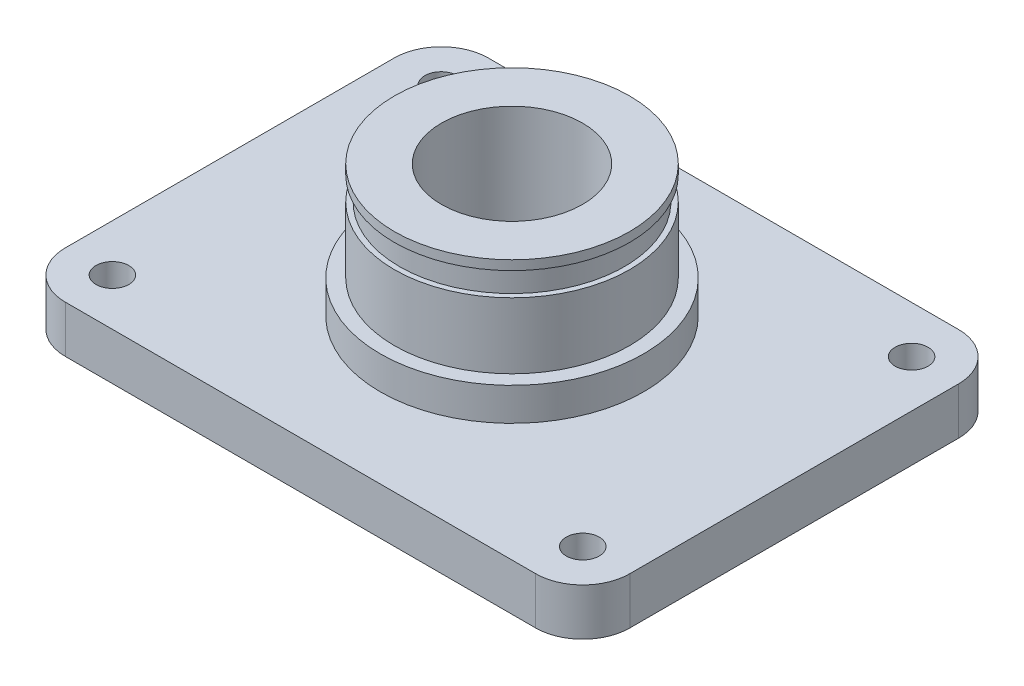
from build123d import *

# Parameters (mm, degrees)
SKETCH1_R           = 12.5
SKETCH1_R_2         = 9.5
BOSS_EXTRUDE1_DEPTH = 14
SKETCH2_W           = 64.506168934
SKETCH2_H           = 47.83380527
BOSS_EXTRUDE2_DEPTH = 5
SKETCH3_R           = 7.5
CUT_EXTRUDE1_DEPTH  = 5
FILLET1_R           = 10
SKETCH4_R           = 41.339159207
SKETCH4_R_2         = 22.478966411
CUT_EXTRUDE2_DEPTH  = 10
SKETCH5_W           = 60
SKETCH5_H           = 44.957932822
SKETCH5_R           = 6
BOSS_EXTRUDE3_DEPTH = 5
FILLET2_R           = 5
SKETCH6_R           = 7.5
CUT_EXTRUDE3_DEPTH  = 10.435721216
SKETCH7_R           = 14
SKETCH7_R_2         = 12.5
BOSS_EXTRUDE4_DEPTH = 3.5
SKETCH8_R           = 13.175914581
SKETCH8_R_2         = 11.95
CUT_EXTRUDE4_DEPTH  = 2.5
BOSS_EXTRUDE5_START = -14
SKETCH9_R           = 9.5
SKETCH9_R_2         = 7.5
BOSS_EXTRUDE5_DEPTH = 14
SKETCH11_R          = 1.75
CUT_EXTRUDE5_DEPTH  = 6.2


with BuildPart() as part:
    # Sketch1 → Boss-Extrude1 (new body)
    with BuildSketch(Plane(origin=(0, 0, 0), x_dir=(1, 0, 0), z_dir=(0, 1, 0))):
        with Locations(Location((0, 0, 0), (0, 0, 270))):
            Circle(SKETCH1_R)
        with Locations(Location((0, 0, 0), (0, 0, 270))):
            Circle(SKETCH1_R_2, mode=Mode.SUBTRACT)
    extrude(amount=BOSS_EXTRUDE1_DEPTH)

    # Sketch2 → Boss-Extrude2 (add)
    with BuildSketch(Plane(origin=(0, 0, 0), x_dir=(-1, 0, 0), z_dir=(0, -1, 0))):
        Rectangle(SKETCH2_W, SKETCH2_H)
    extrude(amount=BOSS_EXTRUDE2_DEPTH)

    # Sketch3 → Cut-Extrude1 (cut)
    with BuildSketch(Plane(origin=(0, 0, 0), x_dir=(1, 0, 0), z_dir=(0, 1, 0))):
        with Locations(Location((0, 0, 0), (0, 0, 270))):
            Circle(SKETCH3_R)
    extrude(amount=-CUT_EXTRUDE1_DEPTH, mode=Mode.SUBTRACT)

    # Fillet1
    fillet1_edges = [part.edges().sort_by_distance(p)[0] for p in [
        (32.253084467, -2.5, -23.916902635),
        (32.253084467, -2.5, 23.916902635),
        (-32.253084467, -2.5, 23.916902635),
        (-32.253084467, -2.5, -23.916902635),
    ]]
    fillet(fillet1_edges, radius=FILLET1_R)

    # Sketch4 → Cut-Extrude2 (cut)
    with BuildSketch(Plane(origin=(0, 0, 0), x_dir=(1, 0, 0), z_dir=(0, 1, 0))):
        Circle(SKETCH4_R)
        with Locations(Location((0, 0, 0), (0, 0, 270))):
            Circle(SKETCH4_R_2, mode=Mode.SUBTRACT)
    extrude(amount=-CUT_EXTRUDE2_DEPTH, mode=Mode.SUBTRACT)

    # Sketch5 → Boss-Extrude3 (add)
    with BuildSketch(Plane(origin=(0, -5, 0), x_dir=(-1, 0, 0), z_dir=(0, -1, 0))):
        Rectangle(SKETCH5_W, SKETCH5_H)
        with Locations(Location((0, 0, 0), (0, 0, 90))):
            Circle(SKETCH5_R, mode=Mode.SUBTRACT)
    extrude(amount=-BOSS_EXTRUDE3_DEPTH)

    # Fillet2
    fillet2_edges = [part.edges().sort_by_distance(p)[0] for p in [
        (30, -2.5, -22.478966411),
        (-30, -2.5, 22.478966411),
        (30, -2.5, 22.478966411),
        (-30, -2.5, -22.478966411),
    ]]
    fillet(fillet2_edges, radius=FILLET2_R)

    # Sketch6 → Cut-Extrude3 (cut)
    with BuildSketch(Plane(origin=(0, -5, 0), x_dir=(-1, 0, 0), z_dir=(0, -1, 0))):
        with Locations(Location((0, 0, 0), (0, 0, 90))):
            Circle(SKETCH6_R)
    extrude(amount=-CUT_EXTRUDE3_DEPTH, mode=Mode.SUBTRACT)

    # Sketch7 → Boss-Extrude4 (add)
    with BuildSketch(Plane(origin=(0, 0, 0), x_dir=(1, 0, 0), z_dir=(0, 1, 0))):
        with Locations(Location((0, 0, 0), (0, 0, 270))):
            Circle(SKETCH7_R)
        with Locations(Location((0, 0, 0), (0, 0, 270))):
            Circle(SKETCH7_R_2, mode=Mode.SUBTRACT)
    extrude(amount=BOSS_EXTRUDE4_DEPTH)

    # Sketch8 → Cut-Extrude4 (cut)
    with BuildSketch(Plane(origin=(0, 13, 0), x_dir=(1, 0, 0), z_dir=(0, 1, 0))):
        Circle(SKETCH8_R)
        with Locations(Location((0, 0, 0), (0, 0, 270))):
            Circle(SKETCH8_R_2, mode=Mode.SUBTRACT)
    extrude(amount=-CUT_EXTRUDE4_DEPTH, mode=Mode.SUBTRACT)

    # Sketch9 → Boss-Extrude5 (add)
    with BuildSketch(Plane(origin=(0, 14, 0), x_dir=(1, 0, 0), z_dir=(0, 1, 0)).offset(BOSS_EXTRUDE5_START)):
        Circle(SKETCH9_R)
        with Locations(Location((0, 0, 0), (0, 0, 90))):
            Circle(SKETCH9_R_2, mode=Mode.SUBTRACT)
    extrude(amount=BOSS_EXTRUDE5_DEPTH)

    # Sketch11 → Cut-Extrude5 (cut)
    with BuildSketch(Plane(origin=(0, 0, 0), x_dir=(1, 0, 0), z_dir=(0, 1, 0))):
        with Locations(Location((-25, 17.478966411, 0), (0, 0, 270))):
            Circle(SKETCH11_R)
        with Locations(Location((25, 17.478966411, 0), (0, 0, 270))):
            Circle(SKETCH11_R)
        with Locations(Location((25, -17.478966411, 0), (0, 0, 270))):
            Circle(SKETCH11_R)
        with Locations(Location((-25, -17.478966411, 0), (0, 0, 270))):
            Circle(SKETCH11_R)
    extrude(amount=-CUT_EXTRUDE5_DEPTH, mode=Mode.SUBTRACT)


solid = part.part
